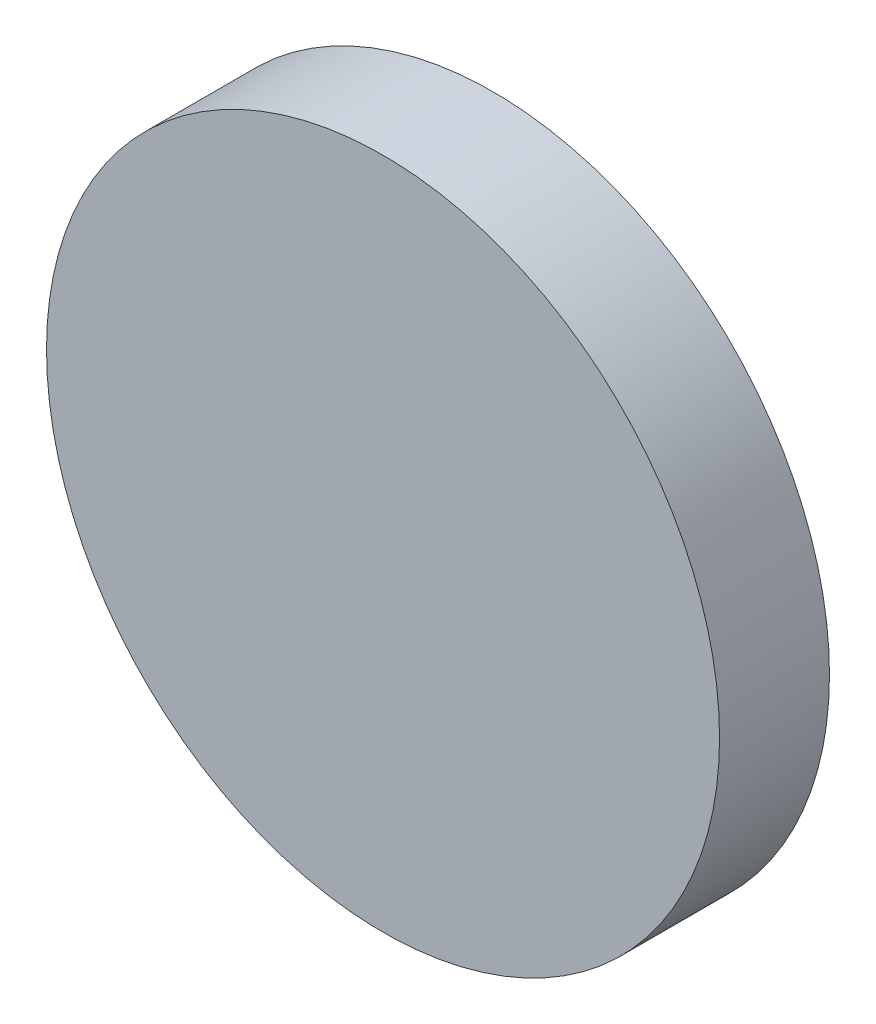
from build123d import *

# Parameters (mm, degrees)
ESQUISSE1_R        = 15
BOSS_EXTRU_1_DEPTH = 4.9


with BuildPart() as part:
    # Esquisse1 → Boss.-Extru.1 (new body)
    with BuildSketch(Plane.XY):
        Circle(ESQUISSE1_R)
    extrude(amount=BOSS_EXTRU_1_DEPTH)


solid = part.part
